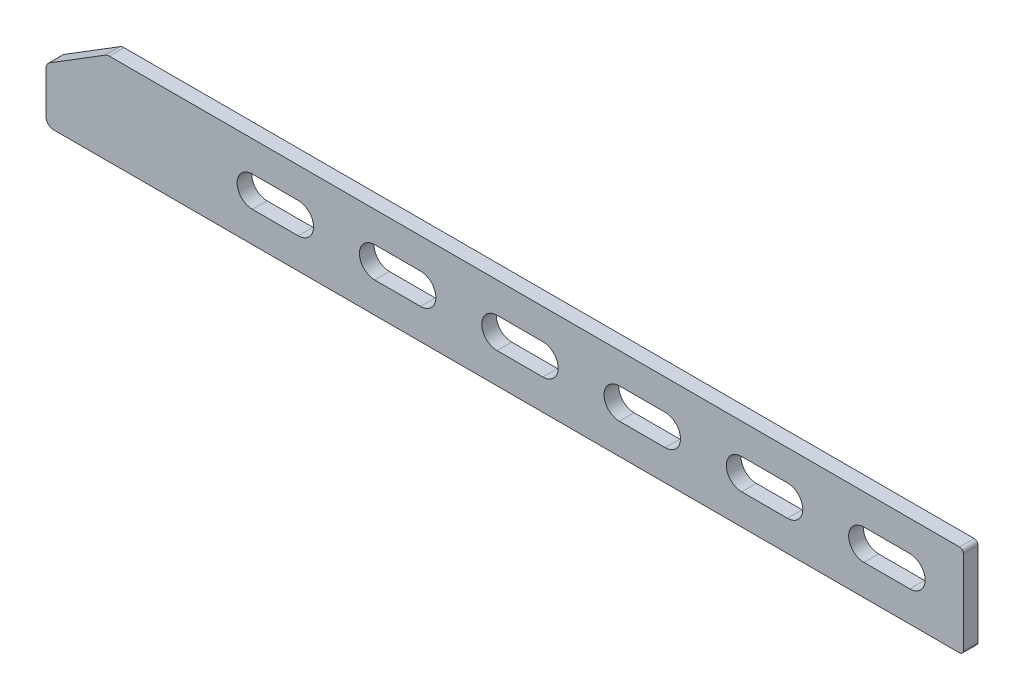
from build123d import *

# Parameters (mm, degrees)
SKETCH1_W           = 177.8
SKETCH1_H           = 19.05
BOSS_EXTRUDE1_DEPTH = 3.048
CUT_EXTRUDE1_DEPTH  = 179.843598722
BOSS_EXTRUDE2_DEPTH = 3.048
FILLET1_R           = 1.5875
FILLET2_R           = 0.79375


with BuildPart() as part:
    # Sketch1 → Boss-Extrude1 (new body)
    with BuildSketch(Plane.XY):
        with Locations((-88.9, 9.525)):
            Rectangle(SKETCH1_W, SKETCH1_H)
    extrude(amount=BOSS_EXTRUDE1_DEPTH)

    # Sketch2 → Cut-Extrude1 (cut, through all)
    with BuildSketch(Plane.XY.offset(3.048)):
        with BuildLine():
            Line((-11.1125, 6.35), (-20.6375, 6.35))
            ThreePointArc((-20.6375, 6.35), (-23.8125, 9.525), (-20.6375, 12.7))
            Line((-20.6375, 12.7), (-11.1125, 12.7))
            ThreePointArc((-11.1125, 12.7), (-7.9375, 9.525), (-11.1125, 6.35))
        make_face()
        with BuildLine():
            Line((-36.5125, 6.35), (-46.0375, 6.35))
            ThreePointArc((-46.0375, 6.35), (-49.2125, 9.525), (-46.0375, 12.7))
            Line((-46.0375, 12.7), (-36.5125, 12.7))
            ThreePointArc((-36.5125, 12.7), (-33.3375, 9.525), (-36.5125, 6.35))
        make_face()
        with BuildLine():
            Line((-61.9125, 6.35), (-71.4375, 6.35))
            ThreePointArc((-71.4375, 6.35), (-74.6125, 9.525), (-71.4375, 12.7))
            Line((-71.4375, 12.7), (-61.9125, 12.7))
            ThreePointArc((-61.9125, 12.7), (-58.7375, 9.525), (-61.9125, 6.35))
        make_face()
        with BuildLine():
            Line((-87.3125, 6.35), (-96.8375, 6.35))
            ThreePointArc((-96.8375, 6.35), (-100.0125, 9.525), (-96.8375, 12.7))
            Line((-96.8375, 12.7), (-87.3125, 12.7))
            ThreePointArc((-87.3125, 12.7), (-84.1375, 9.525), (-87.3125, 6.35))
        make_face()
        with BuildLine():
            Line((-112.7125, 6.35), (-122.2375, 6.35))
            ThreePointArc((-122.2375, 6.35), (-125.4125, 9.525), (-122.2375, 12.7))
            Line((-122.2375, 12.7), (-112.7125, 12.7))
            ThreePointArc((-112.7125, 12.7), (-109.5375, 9.525), (-112.7125, 6.35))
        make_face()
        with BuildLine():
            Line((-138.1125, 6.35), (-147.6375, 6.35))
            ThreePointArc((-147.6375, 6.35), (-150.8125, 9.525), (-147.6375, 12.7))
            Line((-147.6375, 12.7), (-138.1125, 12.7))
            ThreePointArc((-138.1125, 12.7), (-134.9375, 9.525), (-138.1125, 6.35))
        make_face()
    extrude(amount=-CUT_EXTRUDE1_DEPTH, mode=Mode.SUBTRACT)

    # Sketch3 → Boss-Extrude2 (add)
    with BuildSketch(Plane(origin=(0, 0, 0), x_dir=(-1, 0, 0), z_dir=(0, 0, -1))):
        Polygon((177.8, 0), (190.5, 0), (190.5, 11.176), (177.8, 19.05), align=None)
    extrude(amount=-BOSS_EXTRUDE2_DEPTH)

    # Fillet1
    fillet1_edges = [part.edges().sort_by_distance(p)[0] for p in [
        (-190.5, 0, 1.524),
        (-190.5, 11.176, 1.524),
        (-177.8, 19.05, 1.524),
    ]]
    fillet(fillet1_edges, radius=FILLET1_R)

    # Fillet2
    fillet2_edges = [part.edges().sort_by_distance(p)[0] for p in [
        (0, 0, 1.524),
        (0, 19.05, 1.524),
    ]]
    fillet(fillet2_edges, radius=FILLET2_R)


solid = part.part
